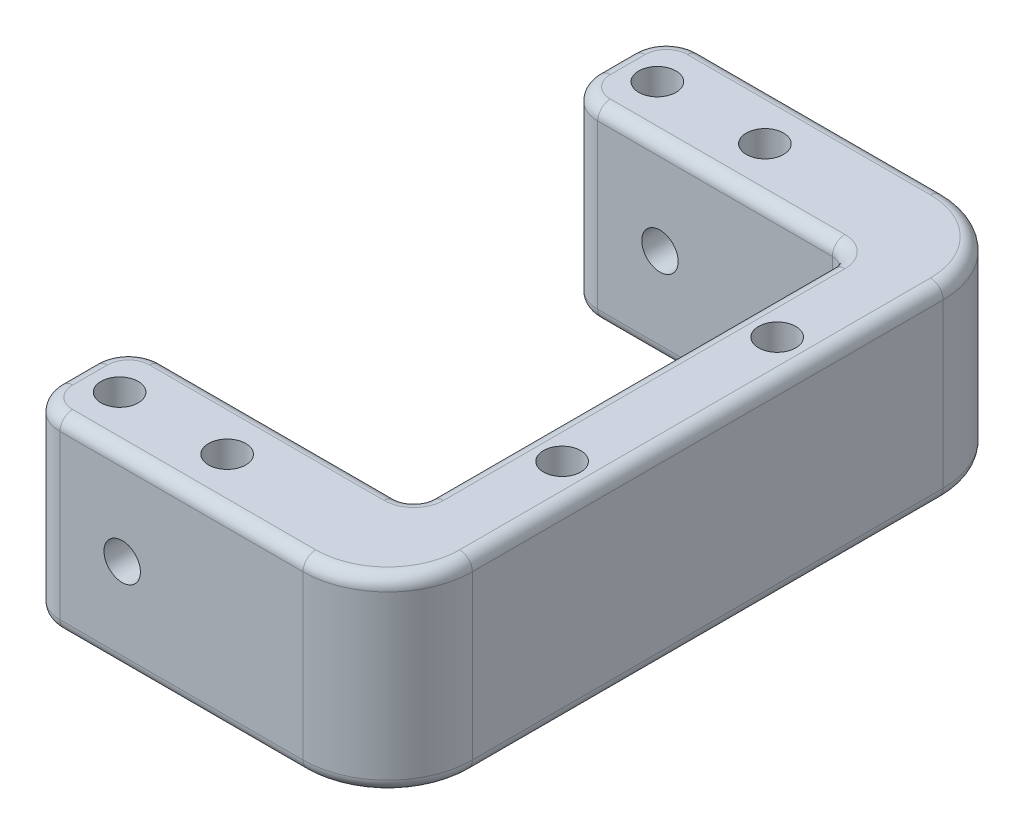
from build123d import *

# Parameters (mm, degrees)
SKETCH1_R           = 2.2
BOSS_EXTRUDE1_DEPTH = 22.2504
FILLET1_R           = 10
FILLET2_R           = 2
FILLET3_R           = 4
FILLET4_R           = 1.5
SKETCH2_R           = 2.15
CUT_EXTRUDE1_DEPTH  = 88.351467531


with BuildPart() as part:
    # Sketch1 → Boss-Extrude1 (new body)
    with BuildSketch(Plane(origin=(0, 0, 0), x_dir=(1, 0, 0), z_dir=(0, 1, 0))):
        Polygon((-5, 6.0452), (28.7, 6.0452), (28.7, 57.4548), (-5, 57.4548), (-5, 69.5452), (37.7, 69.5452), (37.7, -6.0452), (-5, -6.0452), align=None)
        with Locations(Location((0, 0, 0), (0, 0, 90))):
            Circle(SKETCH1_R, mode=Mode.SUBTRACT)
        with Locations(Location((12.7, 0, 0), (0, 0, 90))):
            Circle(SKETCH1_R, mode=Mode.SUBTRACT)
        with Locations(Location((12.7, 63.5, 0), (0, 0, 90))):
            Circle(SKETCH1_R, mode=Mode.SUBTRACT)
        with Locations(Location((0, 63.5, 0), (0, 0, 90))):
            Circle(SKETCH1_R, mode=Mode.SUBTRACT)
        with Locations(Location((33.2, 44.45, 0), (0, 0, 90))):
            Circle(SKETCH1_R, mode=Mode.SUBTRACT)
        with Locations(Location((33.2, 19.05, 0), (0, 0, 90))):
            Circle(SKETCH1_R, mode=Mode.SUBTRACT)
    extrude(amount=BOSS_EXTRUDE1_DEPTH)

    # Fillet1
    fillet1_edges = [part.edges().sort_by_distance(p)[0] for p in [
        (37.7, 11.1252, -69.5452),
        (37.7, 11.1252, 6.0452),
    ]]
    fillet(fillet1_edges, radius=FILLET1_R)

    # Fillet2
    fillet2_edges = [part.edges().sort_by_distance(p)[0] for p in [
        (28.7, 11.1252, -6.0452),
        (28.7, 11.1252, -57.4548),
    ]]
    fillet(fillet2_edges, radius=FILLET2_R)

    # Fillet3
    fillet3_edges = [part.edges().sort_by_distance(p)[0] for p in [
        (-5, 11.1252, 6.0452),
        (-5, 11.1252, -6.0452),
        (-5, 11.1252, -57.4548),
        (-5, 11.1252, -69.5452),
    ]]
    fillet(fillet3_edges, radius=FILLET3_R)

    # Fillet4
    fillet4_edges = [part.edges().sort_by_distance(p)[0] for p in [
        (13.35, 0, -69.5452),
        (13.35, 22.2504, -69.5452),
        (37.7, 0, -31.75),
        (34.771067812, 0, 3.116267812),
        (34.771067812, 0, -66.616267812),
        (37.7, 22.2504, -31.75),
        (34.771067812, 22.2504, 3.116267812),
        (34.771067812, 22.2504, -66.616267812),
        (28.7, 0, -31.75),
        (28.7, 22.2504, -31.75),
        (12.85, 0, -57.4548),
        (12.85, 22.2504, -57.4548),
        (28.114213562, 0, -56.869013562),
        (28.114213562, 22.2504, -56.869013562),
        (28.114213562, 0, -6.630986438),
        (28.114213562, 22.2504, -6.630986438),
        (-5, 0, -63.5),
        (-5, 22.2504, -63.5),
        (13.35, 0, 6.0452),
        (-5, 0, 0),
        (12.85, 0, -6.0452),
        (-3.828427125, 0, 4.873627125),
        (-3.828427125, 0, -4.873627125),
        (-3.828427125, 0, -58.626372875),
        (-3.828427125, 0, -68.373627125),
        (12.85, 22.2504, -6.0452),
        (-5, 22.2504, 0),
        (13.35, 22.2504, 6.0452),
        (-3.828427125, 22.2504, 4.873627125),
        (-3.828427125, 22.2504, -4.873627125),
        (-3.828427125, 22.2504, -58.626372875),
        (-3.828427125, 22.2504, -68.373627125),
    ]]
    fillet(fillet4_edges, radius=FILLET4_R)

    # Sketch2 → Cut-Extrude1 (cut, through all)
    with BuildSketch(Plane.XY.offset(6.0452)):
        with Locations((6.35, 11.1252)):
            Circle(SKETCH2_R)
    extrude(amount=-CUT_EXTRUDE1_DEPTH, mode=Mode.SUBTRACT)


solid = part.part
